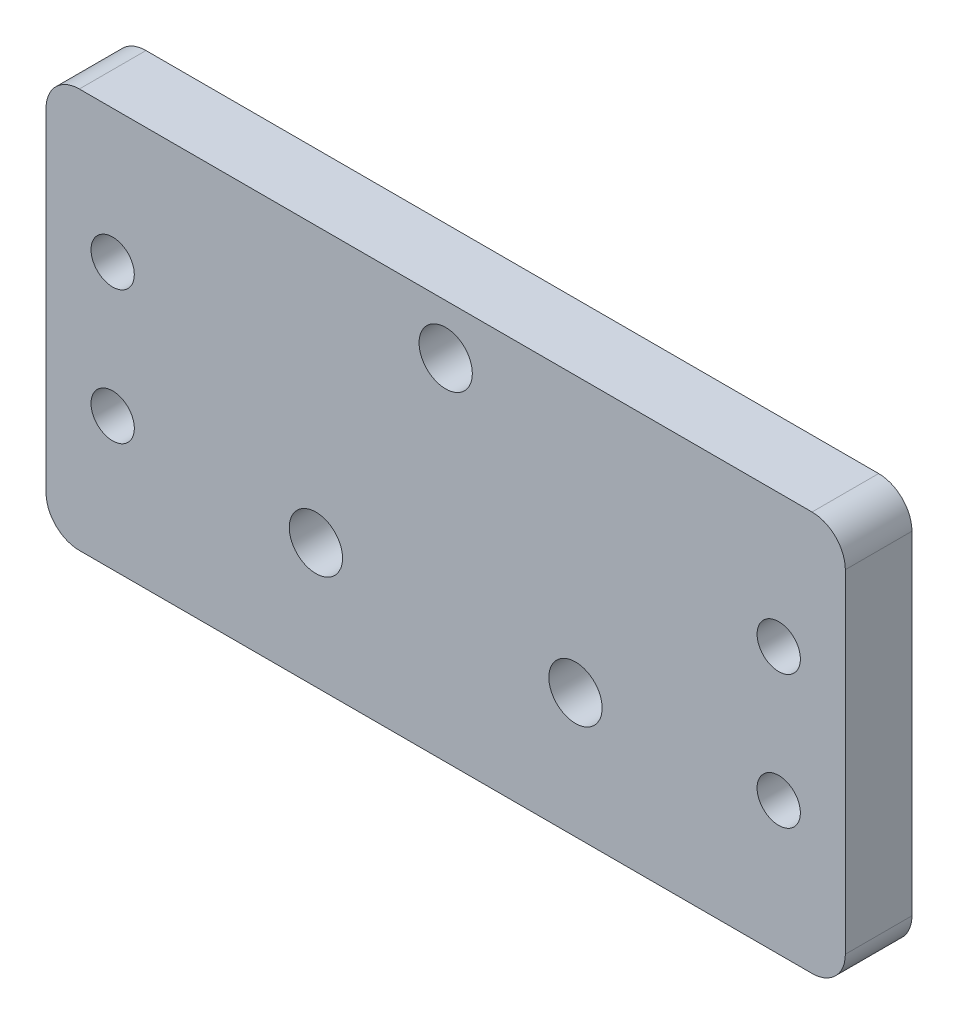
from build123d import *

# Parameters (mm, degrees)
SKETCH_1_W          = 120
SKETCH_1_H          = 60
EXTRUDE_1_DEPTH     = 10
SKETCH_2_R          = 3.25
CUT_EXTRUDE_1_DEPTH = 135.536240471
SKETCH_3_R          = 2.25
CUT_EXTRUDE_2_DEPTH = 135.536240471
SKETCH_4_R          = 4
CUT_EXTRUDE_3_DEPTH = 6
FILLET_1_R          = 5


with BuildPart() as part:
    # ｽｹｯﾁ1 → ﾎﾞｽ - 押し出し1 (new body)
    with BuildSketch(Plane.XY):
        with Locations((60, 30)):
            Rectangle(SKETCH_1_W, SKETCH_1_H)
    extrude(amount=EXTRUDE_1_DEPTH)

    # ｽｹｯﾁ2 → ｶｯﾄ - 押し出し1 (cut, through all)
    with BuildSketch(Plane.XY.offset(10)):
        with Locations((10, 40)):
            Circle(SKETCH_2_R)
        with Locations((110, 40)):
            Circle(SKETCH_2_R)
        with Locations(Location((110, 20, 0), (0, 0, 180))):
            Circle(SKETCH_2_R)
        with Locations(Location((10, 20, 0), (0, 0, 180))):
            Circle(SKETCH_2_R)
    extrude(amount=-CUT_EXTRUDE_1_DEPTH, mode=Mode.SUBTRACT)

    # ｽｹｯﾁ3 → ｶｯﾄ - 押し出し2 (cut, through all)
    with BuildSketch(Plane.XY.offset(10)):
        with Locations((60, 52.5)):
            Circle(SKETCH_3_R)
        with Locations((79.485571585, 18.75)):
            Circle(SKETCH_3_R)
        with Locations(Location((40.514428415, 18.75, 0), (0, 0, 180))):
            Circle(SKETCH_3_R)
    extrude(amount=-CUT_EXTRUDE_2_DEPTH, mode=Mode.SUBTRACT)

    # ｽｹｯﾁ4 → ｶｯﾄ - 押し出し3 (cut)
    with BuildSketch(Plane.XY.offset(10)):
        with Locations((60, 52.5)):
            Circle(SKETCH_4_R)
        with Locations((79.485571585, 18.75)):
            Circle(SKETCH_4_R)
        with Locations((40.514428415, 18.75)):
            Circle(SKETCH_4_R)
    extrude(amount=-CUT_EXTRUDE_3_DEPTH, mode=Mode.SUBTRACT)

    # ﾌｨﾚｯﾄ1
    fillet_1_edges = [part.edges().sort_by_distance(p)[0] for p in [
        (0, 60, 5),
        (120, 60, 5),
        (120, 0, 5),
        (0, 0, 5),
    ]]
    fillet(fillet_1_edges, radius=FILLET_1_R)


solid = part.part
